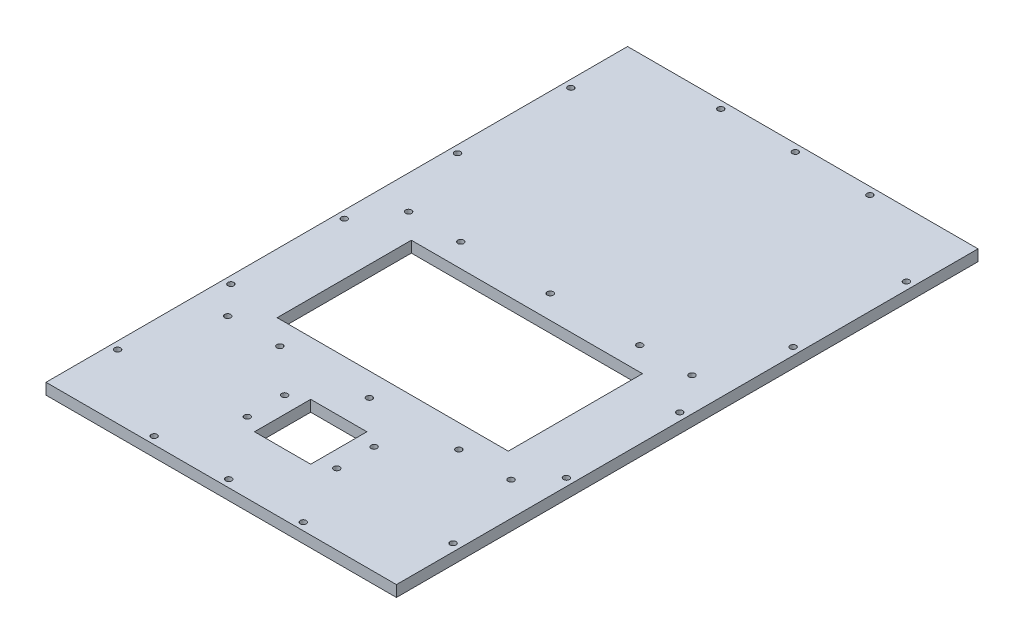
from build123d import *

# Parameters (mm, degrees)
SKETCH1_W                  = 298.45
SKETCH1_H                  = 495.3
BOSS_EXTRUDE1_DEPTH        = 4.7625
CUT_EXTRUDE1_DEPTH         = 290.291114191
CUT_EXTRUDE1_DEPTH_BACK    = 290.291114191
SKETCH3_W                  = 196.85
SKETCH3_H                  = 114.3
SKETCH20_W                 = 47.879
SKETCH20_H                 = 47.879
CUT_EXTRUDE5_DEPTH         = 290.291114191
F_10_CLEARANCE_HOLE1_D     = 5.1054
F_10_CLEARANCE_HOLE1_DEPTH = 10.668
F_10_CLEARANCE_HOLE1_TIP   = 1.533816902
F_10_CLEARANCE_HOLE4_D     = 5.1054
LPATTERN3_COUNT            = 3
LPATTERN3_PITCH            = 63.5
MIRROR2_COPY_1_D           = 5.1054
MIRROR2_COPY_2_D           = 5.1054
F_10_CLEARANCE_HOLE5_D     = 5.1054
LPATTERN4_COUNT            = 3
LPATTERN4_PITCH            = 96.52
LPATTERN4_COL_COUNT        = 3
LPATTERN4_COL_PITCH        = 96.52
MIRROR3_COPY_1_D           = 5.1054
MIRROR3_COPY_2_D           = 5.1054
MIRROR3_COPY_3_D           = 5.1054
MIRROR3_COPY_4_D           = 5.1054
F_10_CLEARANCE_HOLE6_D     = 5.1054
F_10_CLEARANCE_HOLE7_D     = 5.1054


with BuildPart() as part:
    # Sketch1 → Boss-Extrude1 (new, symmetric)
    with BuildSketch(Plane(origin=(0, 0, 0), x_dir=(1, 0, 0), z_dir=(0, 1, 0))):
        Rectangle(SKETCH1_W, SKETCH1_H)
    extrude(amount=BOSS_EXTRUDE1_DEPTH, both=True)

    # Sketch3 → Cut-Extrude1 (cut, two sides: drawn at the far end of the back side and taken through both)
    with BuildSketch(Plane(origin=(0, 4.7625, 0), x_dir=(1, 0, 0), z_dir=(0, 1, 0)).offset(-CUT_EXTRUDE1_DEPTH_BACK)):
        with Locations((0, -44.45)):
            Rectangle(SKETCH3_W, SKETCH3_H)
    extrude(amount=CUT_EXTRUDE1_DEPTH + CUT_EXTRUDE1_DEPTH_BACK, mode=Mode.SUBTRACT)

    # Sketch20 → Cut-Extrude5 (cut, through all)
    with BuildSketch(Plane.XZ.offset(4.7625)):
        with Locations((0, 171.45)):
            Rectangle(SKETCH20_W, SKETCH20_H)
    extrude(amount=-CUT_EXTRUDE5_DEPTH, mode=Mode.SUBTRACT)

    # #10 Clearance Hole1
    with Locations(Plane(origin=(0, -4.7625, 0), x_dir=(-1, 0, 0), z_dir=(0, -1, 0))):
        with Locations((-38.1, -155.575), (38.1, -155.575), (38.1, -187.325), (-38.1, -187.325)):
            Hole(F_10_CLEARANCE_HOLE1_D / 2, depth=F_10_CLEARANCE_HOLE1_DEPTH)
            with Locations((0, 0, -(F_10_CLEARANCE_HOLE1_DEPTH + F_10_CLEARANCE_HOLE1_TIP / 2))):  # 118° drill point
                Cone(0, F_10_CLEARANCE_HOLE1_D / 2, F_10_CLEARANCE_HOLE1_TIP, mode=Mode.SUBTRACT)

    # #10 Clearance Hole4 (through all)
    with Locations(Plane(origin=(0, 4.7625, 0), x_dir=(1, 0, 0), z_dir=(0, 1, 0))):
        with Locations((-63.5, 241.3)):
            f_10_clearance_hole4 = Hole(F_10_CLEARANCE_HOLE4_D / 2)

    # LPattern3: #10 Clearance Hole4 ×3
    with Locations(*[(i * LPATTERN3_PITCH, 0, 0) for i in range(1, LPATTERN3_COUNT)]):
        add(f_10_clearance_hole4, mode=Mode.SUBTRACT)

    # Mirror2: #10 Clearance Hole4 across plane
    add(f_10_clearance_hole4.mirror(Plane.XY), mode=Mode.SUBTRACT)

    # Mirror2 copy 1 (through all)
    with Locations(Plane(origin=(63.5, 4.7625, 0), x_dir=(1, 0, 0), z_dir=(0, 1, 0))):
        with Locations((-63.5, -241.3)):
            Hole(MIRROR2_COPY_1_D / 2)

    # Mirror2 copy 2 (through all)
    with Locations(Plane(origin=(127, 4.7625, 0), x_dir=(1, 0, 0), z_dir=(0, 1, 0))):
        with Locations((-63.5, -241.3)):
            Hole(MIRROR2_COPY_2_D / 2)

    # #10 Clearance Hole5 (through all)
    with Locations(Plane(origin=(0, 4.7625, 0), x_dir=(1, 0, 0), z_dir=(0, 1, 0))):
        with Locations((-142.875, 0)):
            f_10_clearance_hole5 = Hole(F_10_CLEARANCE_HOLE5_D / 2)

    # LPattern4: #10 Clearance Hole5 ×3
    with Locations(*[(0, 0, -i * LPATTERN4_PITCH) for i in range(1, LPATTERN4_COUNT)]):
        add(f_10_clearance_hole5, mode=Mode.SUBTRACT)

    # LPattern4 col: #10 Clearance Hole5 ×3
    with Locations(*[(0, 0, i * LPATTERN4_COL_PITCH) for i in range(1, LPATTERN4_COL_COUNT)]):
        add(f_10_clearance_hole5, mode=Mode.SUBTRACT)

    # Mirror3: #10 Clearance Hole5 across plane
    add(f_10_clearance_hole5.mirror(Plane(origin=(0, 0, 0), x_dir=(0, 0, 1), z_dir=(1, 0, 0))), mode=Mode.SUBTRACT)

    # Mirror3 copy 1 (through all)
    with Locations(Plane(origin=(0, 4.7625, -96.52), x_dir=(-1, 0, 0), z_dir=(0, 1, 0))):
        with Locations((-142.875, 0)):
            Hole(MIRROR3_COPY_1_D / 2)

    # Mirror3 copy 2 (through all)
    with Locations(Plane(origin=(0, 4.7625, -193.04), x_dir=(-1, 0, 0), z_dir=(0, 1, 0))):
        with Locations((-142.875, 0)):
            Hole(MIRROR3_COPY_2_D / 2)

    # Mirror3 copy 3 (through all)
    with Locations(Plane(origin=(0, 4.7625, 96.52), x_dir=(-1, 0, 0), z_dir=(0, 1, 0))):
        with Locations((-142.875, 0)):
            Hole(MIRROR3_COPY_3_D / 2)

    # Mirror3 copy 4 (through all)
    with Locations(Plane(origin=(0, 4.7625, 193.04), x_dir=(-1, 0, 0), z_dir=(0, 1, 0))):
        with Locations((-142.875, 0)):
            Hole(MIRROR3_COPY_4_D / 2)

    # #10 Clearance Hole6 (through all)
    with Locations(Plane(origin=(0, 4.7625, 0), x_dir=(1, 0, 0), z_dir=(0, 1, 0))):
        with Locations((120.65, 32.5755), (120.65, -121.4755), (-120.65, -121.4755), (-120.65, 32.5755)):
            Hole(F_10_CLEARANCE_HOLE6_D / 2)

    # #10 Clearance Hole7 (through all)
    with Locations(Plane(origin=(0, 4.7625, 0), x_dir=(1, 0, 0), z_dir=(0, 1, 0))):
        with Locations((76.2, 32.5755), (0, 32.5755), (-76.2, 32.5755), (76.2, -121.4755), (0, -121.4755), (-76.2, -121.4755)):
            Hole(F_10_CLEARANCE_HOLE7_D / 2)


solid = part.part
